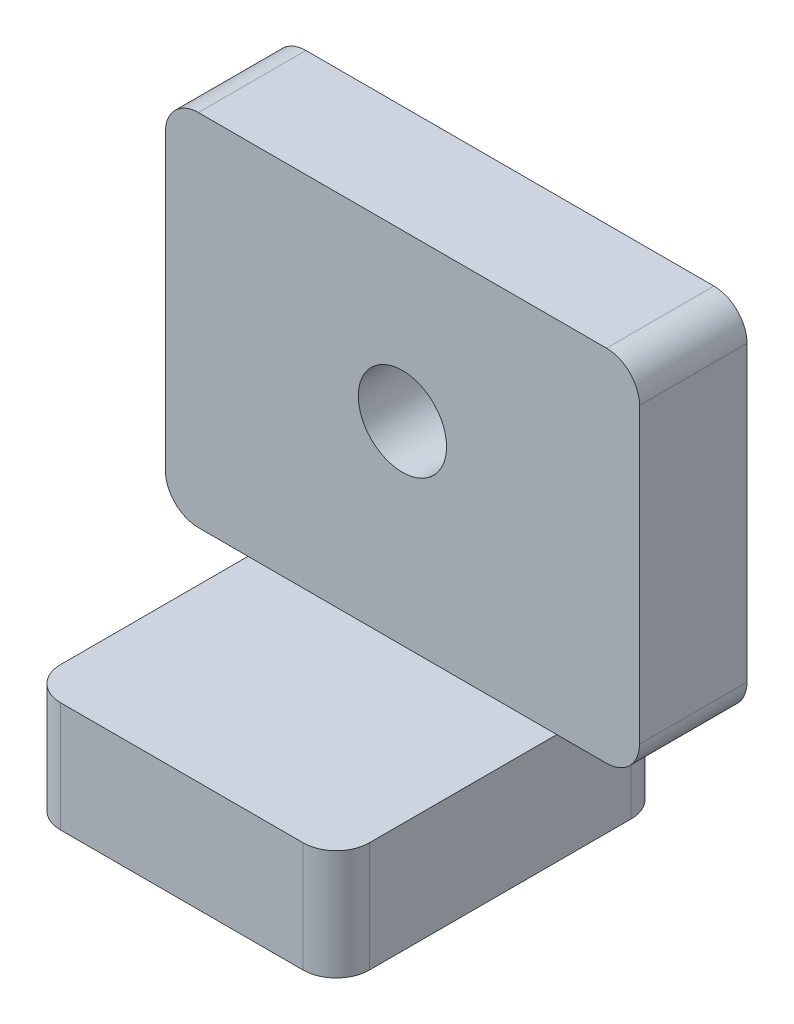
from build123d import *

# Parameters (mm, degrees)
SKETCH1_W                       = 43
SKETCH1_H                       = 32.6
BOSS_EXTRUDE1_DEPTH             = 4.875
SKETCH2_R                       = 4
CUT_EXTRUDE1_DEPTH              = 29.688020148
BOSS_EXTRUDE3_REACH             = 30.688
SKETCH3_W                       = 28
SKETCH3_H                       = 10
BOSS_EXTRUDE3_DIRECTION_2_DEPTH = 20
FILLET1_R                       = 3


with BuildPart() as part:
    # Sketch1 → Boss-Extrude1 (new, symmetric)
    with BuildSketch(Plane.XY):
        Rectangle(SKETCH1_W, SKETCH1_H)
    extrude(amount=BOSS_EXTRUDE1_DEPTH, both=True)

    # Sketch2 → Cut-Extrude1 (cut, through all)
    with BuildSketch(Plane.XY.offset(4.875)):
        with Locations((0, 1.3)):
            Circle(SKETCH2_R)
    extrude(amount=-CUT_EXTRUDE1_DEPTH, mode=Mode.SUBTRACT)

    # Boss-Extrude3: up to this face of the body (flat: up to its plane)
    boss_extrude3_end = Plane(part.part.faces().sort_by_distance((0, -15.760392735, -4.875))[0])
    # Sketch3 → Boss-Extrude3 (add, up to the picked face)
    with BuildSketch(Plane.XY.offset(4.875), mode=Mode.PRIVATE) as boss_extrude3_sk1:
        with Locations((0, -21.3)):
            Rectangle(SKETCH3_W, SKETCH3_H)
    boss_extrude3_tool1 = split(extrude(boss_extrude3_sk1.sketch, amount=-BOSS_EXTRUDE3_REACH, mode=Mode.PRIVATE), bisect_by=boss_extrude3_end, keep=Keep.BOTH, mode=Mode.PRIVATE)
    add(boss_extrude3_tool1.solids().sort_by(Axis((0, -21.3, 4.875), (0, 0, -1)))[0])

    # Sketch3 → Boss-Extrude3 direction 2 (add)
    with BuildSketch(Plane.XY.offset(4.875)):
        with Locations((0, -21.3)):
            Rectangle(SKETCH3_W, SKETCH3_H)
    extrude(amount=BOSS_EXTRUDE3_DIRECTION_2_DEPTH)

    # Fillet1
    fillet1_edges = [part.edges().sort_by_distance(p)[0] for p in [
        (-14, -21.3, -4.875),
        (14, -21.3, -4.875),
        (-14, -21.3, 24.875),
        (14, -21.3, 24.875),
        (21.5, -16.3, 0),
        (-21.5, -16.3, 0),
        (-21.5, 16.3, 0),
        (21.5, 16.3, 0),
    ]]
    fillet(fillet1_edges, radius=FILLET1_R)


solid = part.part
